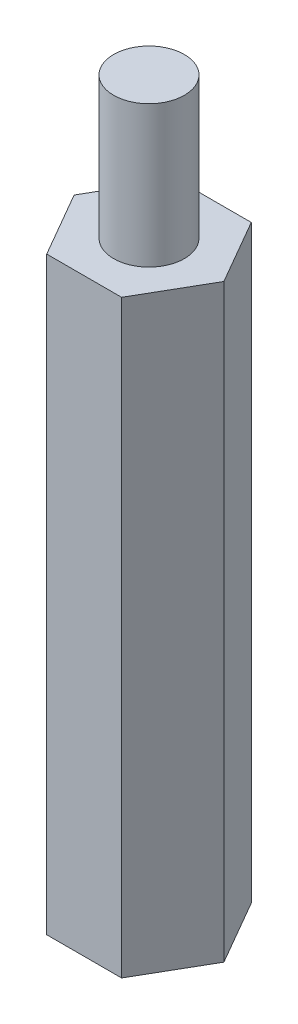
from build123d import *

# Parameters (mm, degrees)
EXTRUDE_1_DEPTH = 25
SKETCH_2_R      = 1.5
EXTRUDE_2_DEPTH = 6
M3X0_5_1_D      = 2.5
M3X0_5_1_DEPTH  = 8.5
M3X0_5_1_TIP    = 0.751075774


with BuildPart() as part:
    # ｽｹｯﾁ1 → ﾎﾞｽ - 押し出し1 (new body)
    with BuildSketch(Plane(origin=(0, 0, 0), x_dir=(1, 0, 0), z_dir=(0, 1, 0))):
        Polygon((1.58771324, -2.75), (3.175426481, 0), (1.58771324, 2.75), (-1.58771324, 2.75), (-3.175426481, 0), (-1.58771324, -2.75), align=None)
    extrude(amount=EXTRUDE_1_DEPTH)

    # ｽｹｯﾁ2 → ﾎﾞｽ - 押し出し2 (add)
    with BuildSketch(Plane(origin=(0, 25, 0), x_dir=(1, 0, 0), z_dir=(0, 1, 0))):
        with Locations(Location((0, 0, 0), (0, 0, 270))):
            Circle(SKETCH_2_R)
    extrude(amount=EXTRUDE_2_DEPTH)

    # M3x0.5 ねじ穴1
    with Locations(Plane(origin=(0, 0, 0), x_dir=(0, 0, -1), z_dir=(0, -1, 0))):
        with Locations((0, 0)):
            Hole(M3X0_5_1_D / 2, depth=M3X0_5_1_DEPTH)
            with Locations((0, 0, -(M3X0_5_1_DEPTH + M3X0_5_1_TIP / 2))):  # 118° drill point
                Cone(0, M3X0_5_1_D / 2, M3X0_5_1_TIP, mode=Mode.SUBTRACT)


solid = part.part
